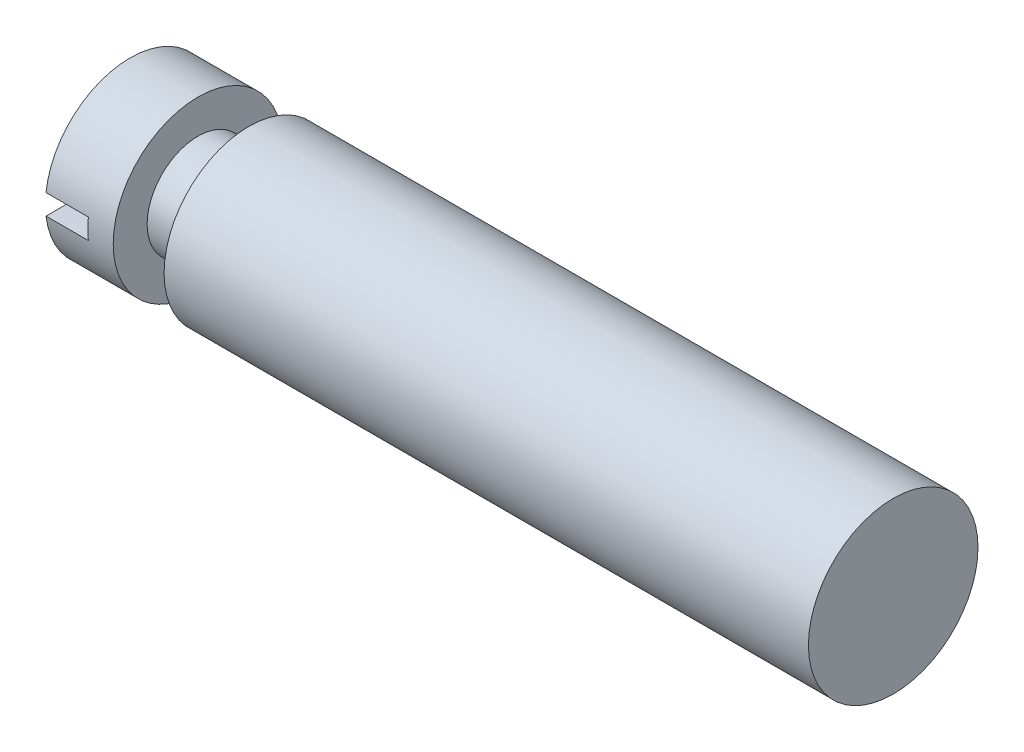
from build123d import *

# Parameters (mm, degrees)
CUT_EXTRUDE1_DEPTH      = 46.552167896
CUT_EXTRUDE1_DEPTH_BACK = 46.552167896
SKETCH2_W               = 2.5
SKETCH2_H               = 1.2


with BuildPart() as part:
    # Sketch1 → Revolve1 (revolve)
    with BuildSketch(Plane.XY, mode=Mode.PRIVATE) as revolve1_sk:
        Polygon((4, 5), (4, 3), (7, 3), (7, 5), (45, 5), (45, 0), (0, 0), (0, 5), align=None)
    revolve(revolve1_sk.sketch.rotate(Axis((0, 0, 0), (1, 0, 0)), 90), axis=Axis((0, 0, 0), (1, 0, 0)))

    # Sketch2 → Cut-Extrude1 (cut, two sides: drawn at the far end of the back side and taken through both)
    with BuildSketch(Plane.XY.offset(-CUT_EXTRUDE1_DEPTH_BACK)):
        with Locations((1.25, 0)):
            Rectangle(SKETCH2_W, SKETCH2_H)
    extrude(amount=CUT_EXTRUDE1_DEPTH + CUT_EXTRUDE1_DEPTH_BACK, mode=Mode.SUBTRACT)


solid = part.part
